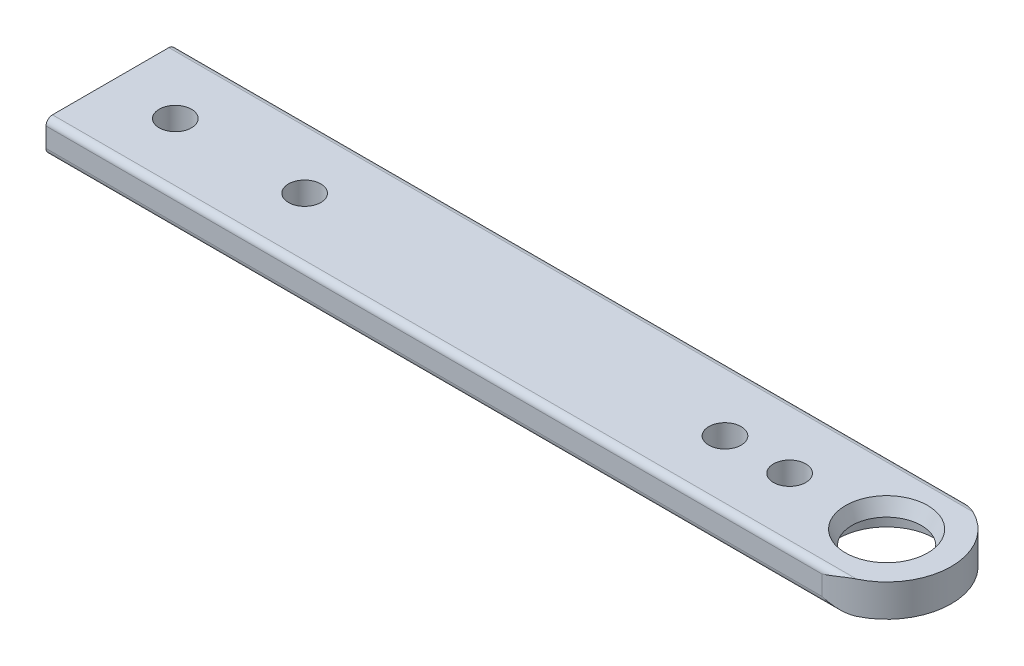
from build123d import *

# Parameters (mm, degrees)
SKETCH1_W           = 165.1
SKETCH1_H           = 25.4
BOSS_EXTRUDE1_DEPTH = 6.35
FILLET1_R           = 1.27
SKETCH2_R           = 3.175
SKETCH2_R_2         = 6.35
CUT_EXTRUDE1_DEPTH  = 84.762252835
SKETCH3_R           = 9.525
CUT_EXTRUDE2_DEPTH  = 3.571875
CUT_EXTRUDE3_DEPTH  = 84.762252835
SKETCH5_R           = 3.175
CUT_EXTRUDE4_DEPTH  = 84.762252956


with BuildPart() as part:
    # Sketch1 → Boss-Extrude1 (new body)
    with BuildSketch(Plane(origin=(0, 0, 0), x_dir=(1, 0, 0), z_dir=(0, 1, 0))):
        Rectangle(SKETCH1_W, SKETCH1_H)
    extrude(amount=BOSS_EXTRUDE1_DEPTH)

    # Fillet1
    fillet1_edges = [part.edges().sort_by_distance(p)[0] for p in [
        (0, 0, -12.7),
        (0, 6.35, -12.7),
        (0, 0, 12.7),
        (0, 6.35, 12.7),
    ]]
    fillet(fillet1_edges, radius=FILLET1_R)

    # Sketch2 → Cut-Extrude1 (cut, through all)
    with BuildSketch(Plane(origin=(0, 6.35, 0), x_dir=(1, 0, 0), z_dir=(0, 1, 0))):
        with Locations((-69.85, 0)):
            Circle(SKETCH2_R)
        with Locations((69.85, 0)):
            Circle(SKETCH2_R_2)
        with Locations((-44.45, 0)):
            Circle(SKETCH2_R)
    extrude(amount=-CUT_EXTRUDE1_DEPTH, mode=Mode.SUBTRACT)

    # Sketch3 → Cut-Extrude2 (cut)
    with BuildSketch(Plane.XZ):
        with Locations((69.85, 0)):
            Circle(SKETCH3_R)
    extrude(amount=-CUT_EXTRUDE2_DEPTH, mode=Mode.SUBTRACT)

    # Sketch4 → Cut-Extrude3 (cut, through all)
    with BuildSketch(Plane.XZ):
        with BuildLine():
            Line((69.85, -12.7), (82.55, -12.7))
            Line((82.55, -12.7), (82.55, 0))
            ThreePointArc((82.55, 0), (78.830256121, -8.980256121), (69.85, -12.7))
        make_face()
        with BuildLine():
            Line((82.55, 0), (82.55, 12.7))
            Line((82.55, 12.7), (69.85, 12.7))
            ThreePointArc((69.85, 12.7), (78.830256121, 8.980256121), (82.55, 0))
        make_face()
    extrude(amount=-CUT_EXTRUDE3_DEPTH, mode=Mode.SUBTRACT)

    # Sketch5 → Cut-Extrude4 (cut, through all)
    with BuildSketch(Plane.XZ):
        with Locations((50.8, 0)):
            Circle(SKETCH5_R)
        with Locations((38.1, 0)):
            Circle(SKETCH5_R)
    extrude(amount=-CUT_EXTRUDE4_DEPTH, mode=Mode.SUBTRACT)

    # Sketch8 → Cut-Revolve1 (revolve, cut)
    with BuildSketch(Plane.XY):
        Polygon((77.91821119, 6.35), (76.2, 6.35), (76.2, 3.571875), (76.681310248, 3.571875), align=None)
    revolve(axis=Axis((69.85, 3.571875, 0), (0, 1, 0)), mode=Mode.SUBTRACT)


solid = part.part
